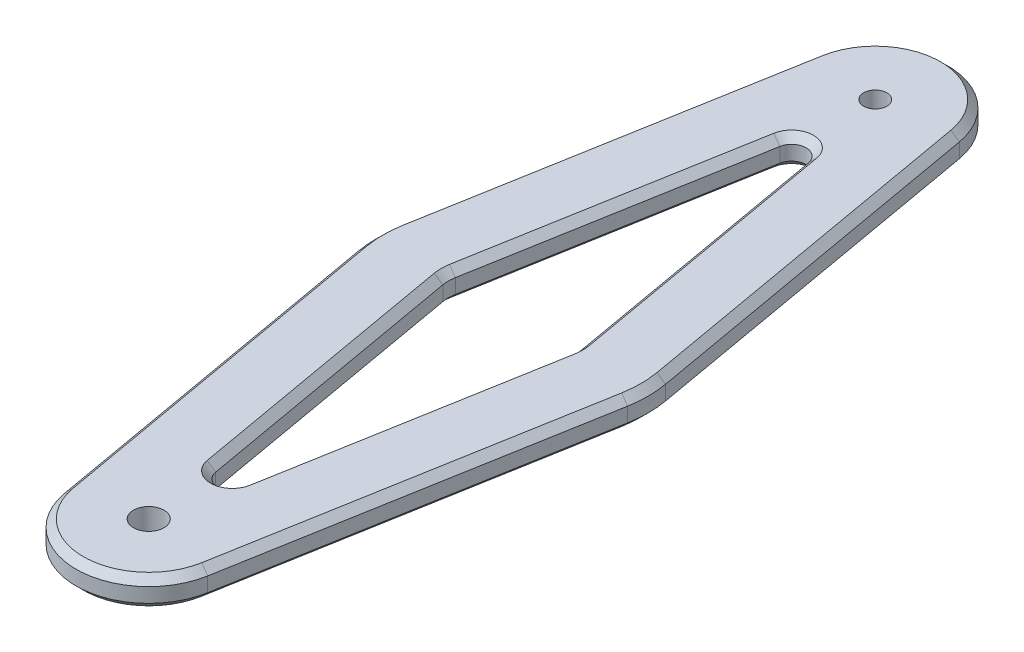
from build123d import *

# Parameters (mm, degrees)
EXTRUDE_1_DEPTH          = 2
SKETCH_2_R               = 1.6
SKETCH_2_R_2             = 2.1
CUT_EXTRUDE_1_DEPTH      = 63.985380966
CUT_EXTRUDE_4_DEPTH      = 63.89004862
CUT_EXTRUDE_4_DEPTH_BACK = 63.89004862
CHAMFER_1_SIZE           = 1


with BuildPart() as part:
    # 草图1 → 凸台-拉伸1 (new, symmetric)
    with BuildSketch(Plane(origin=(0, 0, 0), x_dir=(1, 0, 0), z_dir=(0, 1, 0))):
        with BuildLine():
            Line((-18.511332271, 2.604722665), (-9.84807753, 51.736481777))
            ThreePointArc((-9.84807753, 51.736481777), (0, 60), (9.84807753, 51.736481777))
            Line((9.84807753, 51.736481777), (18.511332271, 2.604722665))
            ThreePointArc((18.511332271, 2.604722665), (18.739215976, 0), (18.511332271, -2.604722665))
            Line((18.511332271, -2.604722665), (9.84807753, -51.736481777))
            ThreePointArc((9.84807753, -51.736481777), (0, -60), (-9.84807753, -51.736481777))
            Line((-9.84807753, -51.736481777), (-18.511332271, -2.604722665))
            ThreePointArc((-18.511332271, -2.604722665), (-18.739215976, 0), (-18.511332271, 2.604722665))
        make_face()
    extrude(amount=EXTRUDE_1_DEPTH, both=True)

    # 草图2 → 切除-拉伸1 (cut, through all)
    with BuildSketch(Plane(origin=(0, 2, 0), x_dir=(1, 0, 0), z_dir=(0, 1, 0))):
        with Locations(Location((0, 50, 0), (0, 0, 270))):
            Circle(SKETCH_2_R)
        with Locations(Location((0, -50, 0), (0, 0, 270))):
            Circle(SKETCH_2_R_2)
    extrude(amount=-CUT_EXTRUDE_1_DEPTH, mode=Mode.SUBTRACT)

    # 草图6 → 切除-拉伸4 (cut, two sides: drawn at the far end of the back side and taken through both)
    with BuildSketch(Plane(origin=(0, 0, 0), x_dir=(1, 0, 0), z_dir=(0, 1, 0)).offset(-CUT_EXTRUDE_4_DEPTH_BACK)):
        with BuildLine():
            Line((-1.969615506, 38.829755389), (-8.663254741, 0.868240888))
            ThreePointArc((-8.663254741, 0.868240888), (-8.739215976, 0), (-8.663254741, -0.868240888))
            Line((-8.663254741, -0.868240888), (-1.969615506, -38.829755389))
            ThreePointArc((-1.969615506, -38.829755389), (0, -40.482459034), (1.969615506, -38.829755389))
            Line((1.969615506, -38.829755389), (8.663254741, -0.868240888))
            ThreePointArc((8.663254741, -0.868240888), (8.739215976, 0), (8.663254741, 0.868240888))
            Line((8.663254741, 0.868240888), (1.969615506, 38.829755389))
            ThreePointArc((1.969615506, 38.829755389), (0, 40.482459034), (-1.969615506, 38.829755389))
        make_face()
    extrude(amount=CUT_EXTRUDE_4_DEPTH + CUT_EXTRUDE_4_DEPTH_BACK, mode=Mode.SUBTRACT)

    # 倒角1
    chamfer_1_edges = [part.edges().sort_by_distance(p)[0] for p in [
        (-14.179704901, -2, 27.170602221),
        (-18.739215976, -2, 0),
        (-14.179704901, -2, -27.170602221),
        (0, -2, -60),
        (-18.739215976, 2, 0),
        (-14.179704901, 2, 27.170602221),
        (0, 2, 60),
        (14.179704901, 2, 27.170602221),
        (18.739215976, 2, 0),
        (14.179704901, 2, -27.170602221),
        (0, -2, 40.482459034),
        (-5.316435124, -2, 19.848998139),
        (-8.739215976, -2, 0),
        (-5.316435124, -2, -19.848998139),
        (0, -2, -40.482459034),
        (5.316435124, -2, -19.848998139),
        (8.739215976, -2, 0),
        (5.316435124, -2, 19.848998139),
        (0, 2, 40.482459034),
        (5.316435124, 2, 19.848998139),
        (8.739215976, 2, 0),
        (5.316435124, 2, -19.848998139),
        (0, 2, -40.482459034),
        (-5.316435124, 2, -19.848998139),
        (-8.739215976, 2, 0),
        (-5.316435124, 2, 19.848998139),
        (0, 2, -60),
        (14.179704901, -2, -27.170602221),
        (-14.179704901, 2, -27.170602221),
        (18.739215976, -2, 0),
        (14.179704901, -2, 27.170602221),
        (0, -2, 60),
    ]]
    chamfer(chamfer_1_edges, length=CHAMFER_1_SIZE)


solid = part.part
